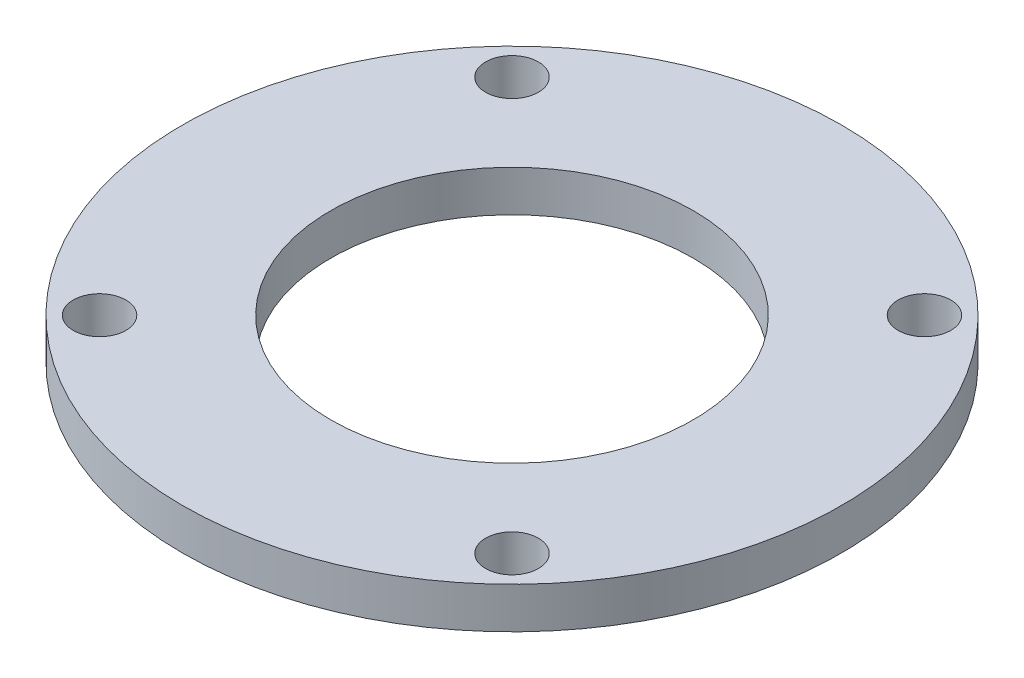
from build123d import *

# Parameters (mm, degrees)
CAP_DISC_SKETCH_R                   = 20
CAP_DISC_DEPTH                      = 2.5
SHAFT_AND_SPACER_CLEARANCE_SKETCH_R = 11
SHAFT_AND_SPACER_CLEARANCE_DEPTH    = 2.7
M3_CAP_CLEARANCE_PATTERN_SKETCH_R   = 1.6
M3_CAP_CLEARANCE_PATTERN_DEPTH      = 2.7


with BuildPart() as part:
    # Cap disc sketch → Cap disc (new body)
    with BuildSketch(Plane(origin=(0, -240, 0), x_dir=(1, 0, 0), z_dir=(0, 1, 0))):
        with Locations(Location((-19.009182883, 53.244882879, 0), (0, 0, 270))):
            Circle(CAP_DISC_SKETCH_R)
    extrude(amount=CAP_DISC_DEPTH)

    # Shaft and spacer clearance sketch → Shaft and spacer clearance (cut)
    with BuildSketch(Plane(origin=(0, -240.1, 0), x_dir=(1, 0, 0), z_dir=(0, 1, 0))):
        with Locations(Location((-19.009182883, 53.244882879, 0), (0, 0, 90))):
            Circle(SHAFT_AND_SPACER_CLEARANCE_SKETCH_R)
    extrude(amount=SHAFT_AND_SPACER_CLEARANCE_DEPTH, mode=Mode.SUBTRACT)

    # M3 cap clearance pattern sketch → M3 cap clearance pattern (cut)
    with BuildSketch(Plane(origin=(0, -240.1, 0), x_dir=(1, 0, 0), z_dir=(0, 1, 0))):
        with Locations(Location((-6.493392856, 40.729092852, 0), (0, 0, 90))):
            Circle(M3_CAP_CLEARANCE_PATTERN_SKETCH_R)
        with Locations(Location((-31.52497291, 40.729092852, 0), (0, 0, 90))):
            Circle(M3_CAP_CLEARANCE_PATTERN_SKETCH_R)
        with Locations(Location((-31.52497291, 65.760672906, 0), (0, 0, 90))):
            Circle(M3_CAP_CLEARANCE_PATTERN_SKETCH_R)
        with Locations(Location((-6.493392856, 65.760672906, 0), (0, 0, 90))):
            Circle(M3_CAP_CLEARANCE_PATTERN_SKETCH_R)
    extrude(amount=M3_CAP_CLEARANCE_PATTERN_DEPTH, mode=Mode.SUBTRACT)


solid = part.part
